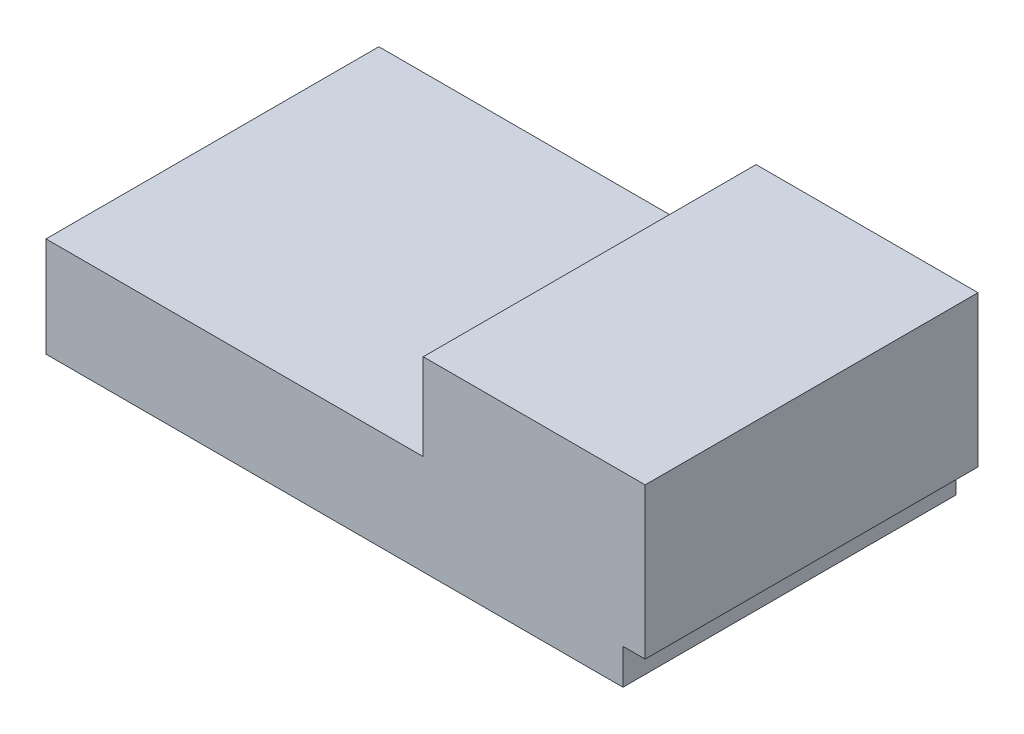
from build123d import *

# Parameters (mm, degrees)
BOSS_EXTRUDE1_DEPTH = 15


with BuildPart() as part:
    # Sketch1 → Boss-Extrude1 (new body)
    with BuildSketch(Plane.XY):
        Polygon((0, 0), (0, 4.5), (17, 4.5), (17, 8.4), (27, 8.4), (27, 1.6), (26, 1.6), (26, 0), align=None)
    extrude(amount=BOSS_EXTRUDE1_DEPTH)


solid = part.part
